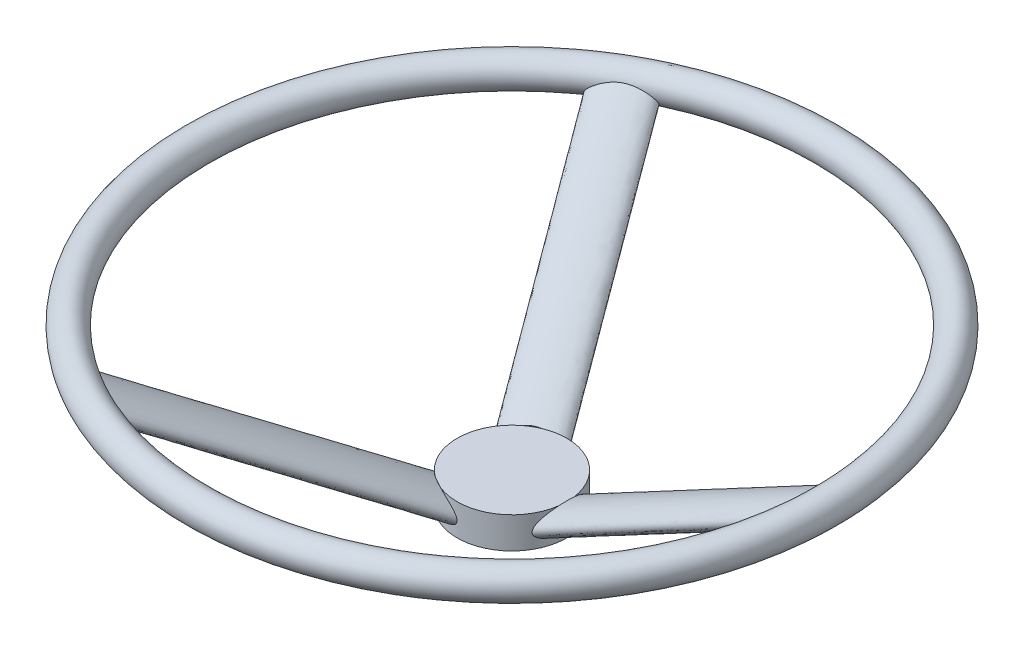
from build123d import *
from build123d.topology import SkipClean

# Parameters (mm, degrees)
SKETCH1_R                = 10
SKETCH1_W                = 35
SKETCH1_H                = 20
BOSS_EXTRUDE1_REACH      = 473.381
BOSS_EXTRUDE1_END_RADIUS = 35
SKETCH4_RX               = 17.5
SKETCH4_RY               = 7.5
CIRPATTERN1_COUNT        = 3


with BuildPart() as part:
    # Sketch1 → Revolve1 (revolve)
    with BuildSketch(Plane.XY, mode=Mode.PRIVATE) as revolve1_sk:
        with Locations((200, 100)):
            Circle(SKETCH1_R)
        with Locations((17.5, 10)):
            Rectangle(SKETCH1_W, SKETCH1_H)
    revolve(revolve1_sk.sketch.rotate(Axis((0, 0, 0), (0, 1, 0)), 90), axis=Axis((0, 0, 0), (0, 1, 0)))

    # Boss-Extrude1: up to this cylinder (the profile starts outside it)
    boss_extrude1_end = Plane(origin=(0, 100.005593, 0), z_dir=(0, -1, 0)) * Cylinder(BOSS_EXTRUDE1_END_RADIUS, 1017.762, mode=Mode.PRIVATE)
    # Sketch4 → Boss-Extrude1 (add, up to the surface)
    with BuildSketch(Plane(origin=(200, 100, 0), x_dir=(0, 0, -1), z_dir=(0.8823529411764705, 0.4705882352941178, 0)), mode=Mode.PRIVATE) as boss_extrude1_sk1:
        with Locations(Location((0, 0.006339284), (0, 0, 0))):
            Ellipse(SKETCH4_RX, SKETCH4_RY)
    boss_extrude1_tool1 = extrude(boss_extrude1_sk1.sketch, amount=-BOSS_EXTRUDE1_REACH, mode=Mode.PRIVATE) - boss_extrude1_end
    boss_extrude1 = boss_extrude1_tool1.solids().sort_by_distance((199.997017, 100.005593, 0))[0]
    add(boss_extrude1)

    # CirPattern1: Boss-Extrude1 ×3 about axis
    with SkipClean():  # the faces are left unmerged after this step: merging them gives an invalid solid
        cirpattern1_axis = Axis((0, 20, 0), (0, -1, 0))
        for i in range(1, CIRPATTERN1_COUNT):
            add(boss_extrude1.rotate(cirpattern1_axis, i * 360 / CIRPATTERN1_COUNT))


solid = part.part
